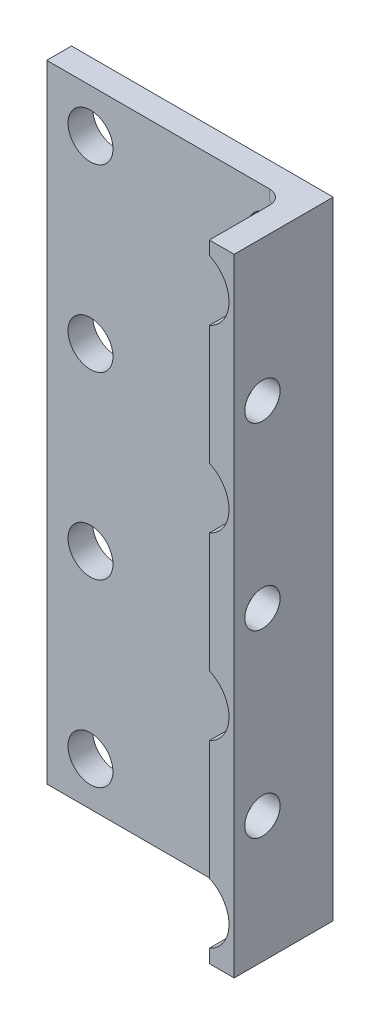
from build123d import *
from build123d.topology import SkipClean

# Parameters (mm, degrees)
SKETCH1_W           = 36.97504
SKETCH1_H           = 88.55
SKETCH1_R           = 3.175
BOSS_EXTRUDE1_DEPTH = 3.5
BOSS_EXTRUDE3_START = 10.5
BOSS_EXTRUDE3_DEPTH = 10.5
CUT_EXTRUDE1_START  = 10.5
CUT_EXTRUDE1_DEPTH  = 10.5
SKETCH2_R           = 2.5
CUT_EXTRUDE2_DEPTH  = 3.5
FILLET1_R           = 2


with BuildPart() as part:
    # Sketch1 → Boss-Extrude1 (new body)
    with BuildSketch(Plane.XY):
        with Locations((18.48752, 44.275)):
            Rectangle(SKETCH1_W, SKETCH1_H)
        with Locations((31.575, 82.375)):
            Circle(SKETCH1_R, mode=Mode.SUBTRACT)
        with Locations((31.575, 56.975)):
            Circle(SKETCH1_R, mode=Mode.SUBTRACT)
        with Locations((31.575, 31.575)):
            Circle(SKETCH1_R, mode=Mode.SUBTRACT)
        with Locations((31.575, 6.175)):
            Circle(SKETCH1_R, mode=Mode.SUBTRACT)
        with Locations((6.175, 6.175)):
            Circle(SKETCH1_R, mode=Mode.SUBTRACT)
        with Locations((6.175, 31.575)):
            Circle(SKETCH1_R, mode=Mode.SUBTRACT)
        with Locations((6.175, 56.975)):
            Circle(SKETCH1_R, mode=Mode.SUBTRACT)
        with Locations((6.175, 82.375)):
            Circle(SKETCH1_R, mode=Mode.SUBTRACT)
    extrude(amount=-BOSS_EXTRUDE1_DEPTH)

    # Sketch1<4> → Boss-Extrude3 (add)
    with SkipClean():  # the faces are left unmerged after this step: merging them gives an invalid solid
        with BuildSketch(Plane.XY.offset(BOSS_EXTRUDE3_START)):
            with BuildLine():
                Line((33.47504, 0), (36.97504, 0))
                Line((36.97504, 0), (36.97504, 88.55))
                Line((36.97504, 88.55), (33.47504, 88.55))
                Line((33.47504, 88.55), (33.47504, 84.918712444))
                ThreePointArc((33.47504, 84.918712444), (34.75, 82.375), (33.47504, 79.831287556))
                Line((33.47504, 79.831287556), (33.47504, 59.518712444))
                ThreePointArc((33.47504, 59.518712444), (34.75, 56.975), (33.47504, 54.431287556))
                Line((33.47504, 54.431287556), (33.47504, 34.118712444))
                ThreePointArc((33.47504, 34.118712444), (34.75, 31.575), (33.47504, 29.031287556))
                Line((33.47504, 29.031287556), (33.47504, 8.718712444))
                ThreePointArc((33.47504, 8.718712444), (34.75, 6.175), (33.47504, 3.631287556))
                Line((33.47504, 3.631287556), (33.47504, 0))
            make_face()
        extrude(amount=-BOSS_EXTRUDE3_DEPTH)

    # Sketch1<5> → Cut-Extrude1 (cut)
    with BuildSketch(Plane.XY.offset(CUT_EXTRUDE1_START)):
        with BuildLine():
            ThreePointArc((36.25, 82.375), (35.495351515, 84.921854727), (33.47504, 86.646471994))
            Line((33.47504, 86.646471994), (33.47504, 84.918712444))
            ThreePointArc((33.47504, 84.918712444), (34.413419631, 83.797673188), (34.75, 82.375))
            ThreePointArc((34.75, 82.375), (34.413419631, 80.952326812), (33.47504, 79.831287556))
            Line((33.47504, 79.831287556), (33.47504, 78.103528006))
            ThreePointArc((33.47504, 78.103528006), (35.495351515, 79.828145273), (36.25, 82.375))
        make_face()
        with BuildLine():
            Line((33.47504, 84.918712444), (33.47504, 86.646471994))
            ThreePointArc((33.47504, 86.646471994), (26.9, 82.375), (33.47504, 78.103528006))
            Line((33.47504, 78.103528006), (33.47504, 79.831287556))
            ThreePointArc((33.47504, 79.831287556), (28.4, 82.375), (33.47504, 84.918712444))
        make_face()
        with BuildLine():
            ThreePointArc((36.25, 56.975), (35.495351515, 59.521854727), (33.47504, 61.246471994))
            Line((33.47504, 61.246471994), (33.47504, 59.518712444))
            ThreePointArc((33.47504, 59.518712444), (34.413419631, 58.397673188), (34.75, 56.975))
            ThreePointArc((34.75, 56.975), (34.413419631, 55.552326812), (33.47504, 54.431287556))
            Line((33.47504, 54.431287556), (33.47504, 52.703528006))
            ThreePointArc((33.47504, 52.703528006), (35.495351515, 54.428145273), (36.25, 56.975))
        make_face()
        with BuildLine():
            Line((33.47504, 59.518712444), (33.47504, 61.246471994))
            ThreePointArc((33.47504, 61.246471994), (26.9, 56.975), (33.47504, 52.703528006))
            Line((33.47504, 52.703528006), (33.47504, 54.431287556))
            ThreePointArc((33.47504, 54.431287556), (28.4, 56.975), (33.47504, 59.518712444))
        make_face()
        with BuildLine():
            ThreePointArc((33.47504, 35.846471994), (26.9, 31.575), (33.47504, 27.303528006))
            Line((33.47504, 27.303528006), (33.47504, 29.031287556))
            ThreePointArc((33.47504, 29.031287556), (28.4, 31.575), (33.47504, 34.118712444))
            Line((33.47504, 34.118712444), (33.47504, 35.846471994))
        make_face()
        with BuildLine():
            Line((33.47504, 29.031287556), (33.47504, 27.303528006))
            ThreePointArc((33.47504, 27.303528006), (35.495351515, 29.028145273), (36.25, 31.575))
            ThreePointArc((36.25, 31.575), (35.495351515, 34.121854727), (33.47504, 35.846471994))
            Line((33.47504, 35.846471994), (33.47504, 34.118712444))
            ThreePointArc((33.47504, 34.118712444), (34.413419631, 32.997673188), (34.75, 31.575))
            ThreePointArc((34.75, 31.575), (34.413419631, 30.152326812), (33.47504, 29.031287556))
        make_face()
        with BuildLine():
            ThreePointArc((33.47504, 10.446471994), (26.9, 6.175), (33.47504, 1.903528006))
            Line((33.47504, 1.903528006), (33.47504, 3.631287556))
            ThreePointArc((33.47504, 3.631287556), (28.4, 6.175), (33.47504, 8.718712444))
            Line((33.47504, 8.718712444), (33.47504, 10.446471994))
        make_face()
        with BuildLine():
            Line((33.47504, 3.631287556), (33.47504, 1.903528006))
            ThreePointArc((33.47504, 1.903528006), (35.495351515, 3.628145273), (36.25, 6.175))
            ThreePointArc((36.25, 6.175), (35.495351515, 8.721854727), (33.47504, 10.446471994))
            Line((33.47504, 10.446471994), (33.47504, 8.718712444))
            ThreePointArc((33.47504, 8.718712444), (34.413419631, 7.597673188), (34.75, 6.175))
            ThreePointArc((34.75, 6.175), (34.413419631, 4.752326812), (33.47504, 3.631287556))
        make_face()
    extrude(amount=-CUT_EXTRUDE1_DEPTH, mode=Mode.SUBTRACT)

    # Sketch2 → Cut-Extrude2 (cut)
    with BuildSketch(Plane(origin=(36.97504, 0, 0), x_dir=(0, 0, -1), z_dir=(1, 0, 0))):
        with Locations((-6.5, 17.849330816)):
            Circle(SKETCH2_R)
        with Locations((-6.5, 43.249330816)):
            Circle(SKETCH2_R)
        with Locations((-6.5, 68.649330816)):
            Circle(SKETCH2_R)
    extrude(amount=-CUT_EXTRUDE2_DEPTH, mode=Mode.SUBTRACT)

    # Fillet1
    fillet1_edges = [part.edges().sort_by_distance(p)[0] for p in [
        (33.47504, 44.275, 0),
        (33.47504, 18.875, 0),
        (33.47504, 0.951764003, 0),
        (33.47504, 87.598235997, 0),
        (33.47504, 69.675, 0),
    ]]
    fillet(fillet1_edges, radius=FILLET1_R)


solid = part.part
